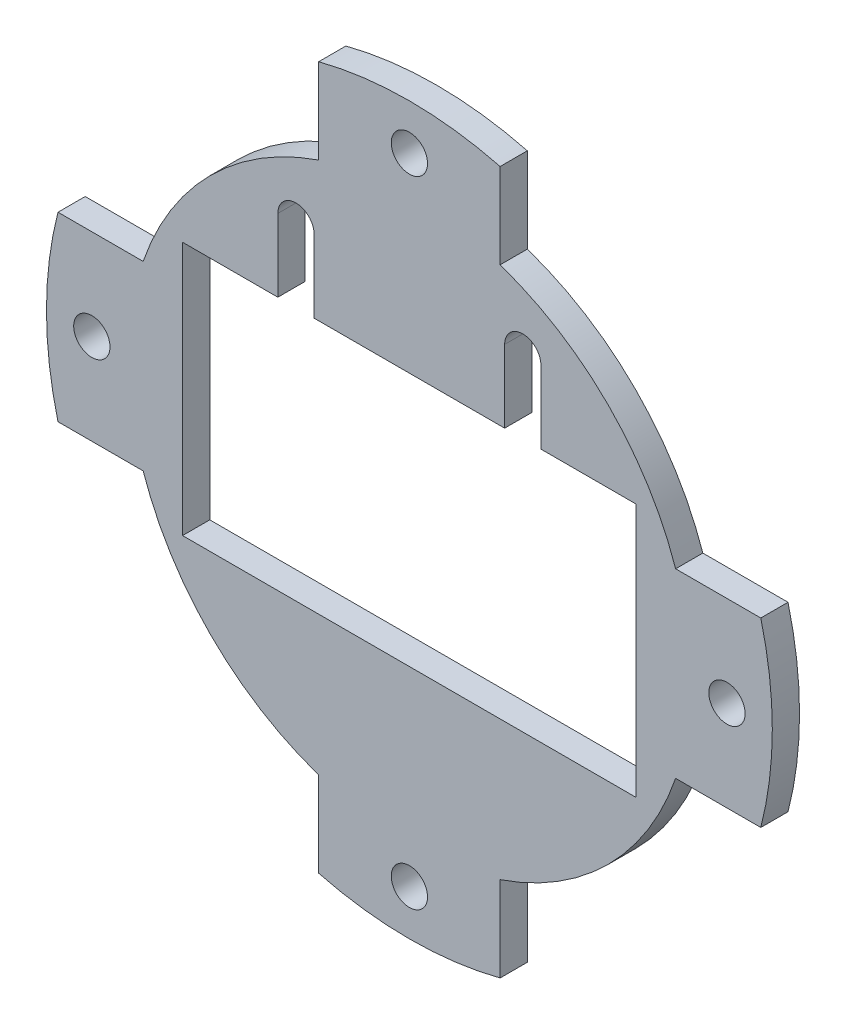
from build123d import *

# Parameters (mm, degrees)
BOSS_EXTRUDE1_DEPTH = 3
CUT_EXTRUDE1_REACH  = 58.648
SKETCH2_W           = 50
SKETCH2_H           = 28
CUT_EXTRUDE2_REACH  = 58.648
SKETCH4_R           = 2
CUT_EXTRUDE3_DEPTH  = 10


with BuildPart() as part:
    # Sketch1 → Boss-Extrude1 (new body)
    with BuildSketch(Plane.XY):
        with BuildLine():
            Line((10, 29.342801502), (10, 38.729833462))
            ThreePointArc((10, 38.729833462), (0, 40), (-10, 38.729833462))
            Line((-10, 38.729833462), (-10, 29.342801502))
            ThreePointArc((-10, 29.342801502), (-21.920310217, 21.920310217), (-29.342801502, 10))
            Line((-29.342801502, 10), (-38.729833462, 10))
            ThreePointArc((-38.729833462, 10), (-40, 0), (-38.729833462, -10))
            Line((-38.729833462, -10), (-29.342801502, -10))
            ThreePointArc((-29.342801502, -10), (-21.920310217, -21.920310217), (-10, -29.342801502))
            Line((-10, -29.342801502), (-10, -38.729833462))
            ThreePointArc((-10, -38.729833462), (0, -40), (10, -38.729833462))
            Line((10, -38.729833462), (10, -29.342801502))
            ThreePointArc((10, -29.342801502), (21.920310217, -21.920310217), (29.342801502, -10))
            Line((29.342801502, -10), (38.729833462, -10))
            ThreePointArc((38.729833462, -10), (40, 0), (38.729833462, 10))
            Line((38.729833462, 10), (29.342801502, 10))
            ThreePointArc((29.342801502, 10), (21.920310217, 21.920310217), (10, 29.342801502))
        make_face()
    extrude(amount=BOSS_EXTRUDE1_DEPTH)

    # Sketch2 → Cut-Extrude1 (cut, up to next)
    with BuildSketch(Plane.XY.offset(3), mode=Mode.PRIVATE) as cut_extrude1_sk1:
        Rectangle(SKETCH2_W, SKETCH2_H)
    cut_extrude1_tool1 = extrude(cut_extrude1_sk1.sketch, amount=-CUT_EXTRUDE1_REACH, mode=Mode.PRIVATE) & part.part
    add(cut_extrude1_tool1.solids().sort_by_distance((0, 0, 3))[0], mode=Mode.SUBTRACT)

    # Sketch3 → Cut-Extrude2 (cut, up to next)
    with BuildSketch(Plane.XY.offset(3), mode=Mode.PRIVATE) as cut_extrude2_sk1:
        with BuildLine():
            Line((-10.5, 22), (-10.5, 14))
            Line((-10.5, 14), (-14.5, 14))
            Line((-14.5, 14), (-14.5, 22))
            ThreePointArc((-14.5, 22), (-12.5, 24), (-10.5, 22))
        make_face()
    cut_extrude2_tool1 = extrude(cut_extrude2_sk1.sketch, amount=-CUT_EXTRUDE2_REACH, mode=Mode.PRIVATE) & part.part
    # Sketch3 → Cut-Extrude2 (cut, up to next)
    with BuildSketch(Plane.XY.offset(3), mode=Mode.PRIVATE) as cut_extrude2_sk2:
        with BuildLine():
            Line((10.5, 22), (10.5, 14))
            Line((10.5, 14), (14.5, 14))
            Line((14.5, 14), (14.5, 22))
            ThreePointArc((14.5, 22), (12.5, 24), (10.5, 22))
        make_face()
    cut_extrude2_tool2 = extrude(cut_extrude2_sk2.sketch, amount=-CUT_EXTRUDE2_REACH, mode=Mode.PRIVATE) & part.part
    add(cut_extrude2_tool1.solids().sort_by_distance((-12.5, 18.795808, 3))[0], mode=Mode.SUBTRACT)
    add(cut_extrude2_tool2.solids().sort_by_distance((12.5, 18.795808, 3))[0], mode=Mode.SUBTRACT)

    # Sketch4 → Cut-Extrude3 (cut)
    with BuildSketch(Plane.XY.offset(3)):
        with Locations((0, 35)):
            Circle(SKETCH4_R)
        with Locations((35, 0)):
            Circle(SKETCH4_R)
        with Locations((0, -35)):
            Circle(SKETCH4_R)
        with Locations((-35, 0)):
            Circle(SKETCH4_R)
    extrude(amount=-CUT_EXTRUDE3_DEPTH, mode=Mode.SUBTRACT)


solid = part.part
